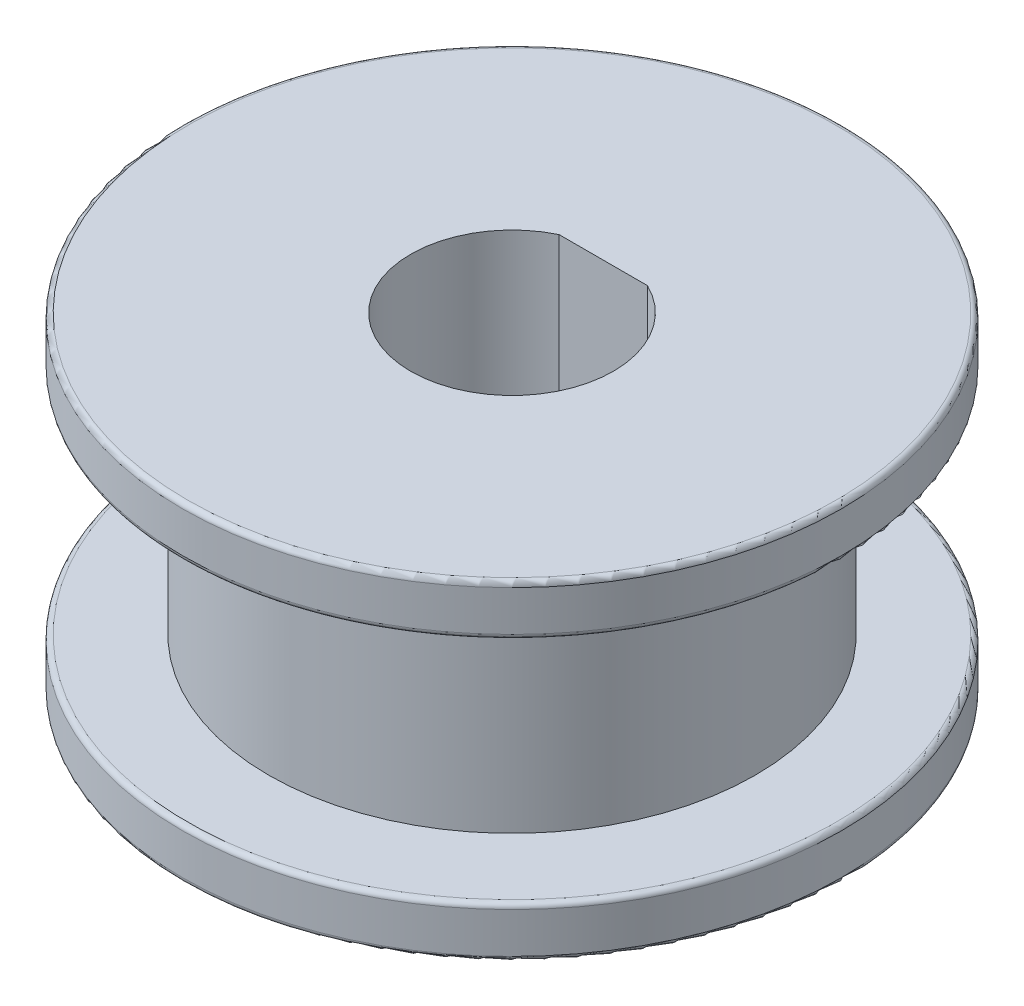
from build123d import *

# Parameters (mm, degrees)
SKETCH_2_R          = 6.5
EXTRUDE_1_DEPTH     = 6.5
SKETCH_4_R          = 6.5
SKETCH_4_R_2        = 4.8
CUT_EXTRUDE_1_DEPTH = 4.5
FILLET_1_R          = 0.1


with BuildPart() as part:
    # 草图2 → 凸台-拉伸1 (new body)
    with BuildSketch(Plane(origin=(0, 0, 0), x_dir=(1, 0, 0), z_dir=(0, 1, 0))):
        with Locations(Location((0, 0, 0), (0, 0, 90))):
            Circle(SKETCH_2_R)
        with BuildLine():
            Line((0.871779789, 1.8), (-0.871779789, 1.8))
            ThreePointArc((-0.871779789, 1.8), (0, -2), (0.871779789, 1.8))
        make_face(mode=Mode.SUBTRACT)
    extrude(amount=EXTRUDE_1_DEPTH)

    # 草图4 → 切除-拉伸1 (cut)
    with BuildSketch(Plane(origin=(0, 1, 0), x_dir=(-1, 0, 0), z_dir=(0, -1, 0))):
        with Locations(Location((0, 0, 0), (0, 0, 90))):
            Circle(SKETCH_4_R)
        with Locations(Location((0, 0, 0), (0, 0, 90))):
            Circle(SKETCH_4_R_2, mode=Mode.SUBTRACT)
    extrude(amount=-CUT_EXTRUDE_1_DEPTH, mode=Mode.SUBTRACT)

    # 圆角1
    fillet_1_edges = [part.edges().sort_by_distance(p)[0] for p in [
        (0, 5.5, 6.5),
        (0, 1, 6.5),
        (0, 0, 6.5),
        (0, 6.5, 6.5),
    ]]
    fillet(fillet_1_edges, radius=FILLET_1_R)


solid = part.part
